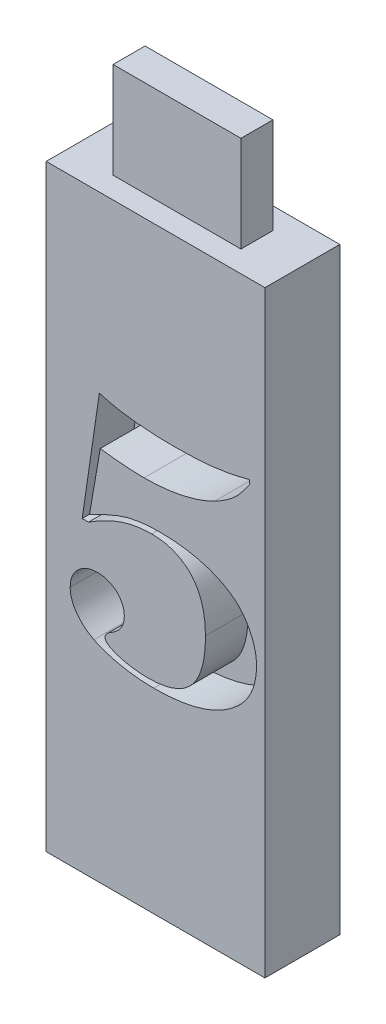
from build123d import *

# Parameters (mm, degrees)
SKETCH1_W           = 17.38
SKETCH1_H           = 47.498
BOSS_EXTRUDE1_DEPTH = 5.95
CUT_EXTRUDE1_DEPTH  = 3.41
SKETCH3_W           = 10.16
SKETCH3_H           = 2.54
BOSS_EXTRUDE2_DEPTH = 7.62


with BuildPart() as part:
    # Sketch1 → Boss-Extrude1 (new body)
    with BuildSketch(Plane.XY):
        Rectangle(SKETCH1_W, SKETCH1_H)
    extrude(amount=BOSS_EXTRUDE1_DEPTH)

    # Sketch2 → Cut-Extrude1 (cut)
    with BuildSketch(Plane.XY.offset(5.95)):
        with BuildLine():
            Line((7.442756003, 9.924455156), (7.491268126, 9.618455606))
            add(Edge.make_bspline(
                [(7.491268126, 9.618455606), (7.388196446, 9.466942554), (7.190794115, 9.176765567), (6.883635039, 8.77416687), (6.580334345, 8.424256906), (6.271574884, 8.117843462), (5.940370317, 7.841299159), (5.568441188, 7.578876003), (5.153754118, 7.310436522), (4.852926765, 7.147246701), (4.696223459, 7.062239856)],
                knots=[0, 0, 0, 0, 1.145964768, 2.194745584, 3.165202406, 4.03990847, 4.912501504, 5.860303535, 6.885415487, 8, 8, 8, 8], degree=3))
            add(Edge.make_bspline(
                [(4.696223459, 7.062239856), (4.499744398, 6.967232704), (4.102902364, 6.775340341), (3.474153814, 6.538191996), (2.813554004, 6.333237061), (2.120776353, 6.162580703), (1.399657714, 6.026815112), (0.651510405, 5.937381635), (-0.120298453, 5.873381172), (-0.643704604, 5.867395245), (-0.908792682, 5.86436357)],
                knots=[0, 0, 0, 0, 0.905325806, 1.828547692, 2.785348579, 3.774441141, 4.787925238, 5.828395329, 6.90015334, 8, 8, 8, 8], degree=3))
            add(Edge.make_bspline(
                [(-0.908792682, 5.86436357), (-1.183775776, 5.868319524), (-1.744155055, 5.876381236), (-2.60042752, 5.931891418), (-3.488027549, 6.016072254), (-4.088461448, 6.098524731), (-4.394202187, 6.140509505)],
                knots=[0, 0, 0, 0, 0.943008224, 1.921726389, 2.941743778, 4, 4, 4, 4], degree=3))
            Line((-4.394202187, 6.140509505), (-5.245030203, 1.177346077))
            add(Edge.make_bspline(
                [(-5.245030203, 1.177346077), (-5.099692133, 1.252367706), (-4.817426132, 1.398069757), (-4.4023402, 1.604243124), (-4.006704111, 1.790847965), (-3.632644493, 1.958676402), (-3.278177346, 2.103991861), (-2.947838119, 2.237174313), (-2.634386649, 2.343936776), (-2.239987634, 2.466535927), (-1.735943769, 2.588441657), (-1.096664304, 2.685171937), (-0.408909829, 2.752005624), (0.066252368, 2.757006699), (0.311473815, 2.759587651)],
                knots=[0, 0, 0, 0, 1.006594111, 1.95494061, 2.852161939, 3.698632082, 4.47771994, 5.20984462, 5.890144692, 6.514895121, 7.751501423, 9.076797217, 10.491395109, 12, 12, 12, 12], degree=3))
            add(Edge.make_bspline(
                [(0.311473815, 2.759587651), (0.535398839, 2.755977577), (0.974846729, 2.748892886), (1.620475428, 2.715284292), (2.237431508, 2.640791764), (2.828133868, 2.549610207), (3.391581711, 2.431161677), (3.926410539, 2.283829718), (4.436803767, 2.118613947), (4.916396667, 1.918999578), (5.371826845, 1.701125088), (5.793685602, 1.447774573), (6.191678015, 1.175540089), (6.432055206, 0.966979497), (6.550879266, 0.863883124)],
                knots=[0, 0, 0, 0, 1.209491551, 2.373600323, 3.489351857, 4.563959151, 5.600865615, 6.596587735, 7.558914106, 8.495791867, 9.400120309, 10.282627716, 11.15106276, 12, 12, 12, 12], degree=3))
            add(Edge.make_bspline(
                [(6.550879266, 0.863883124), (6.663701743, 0.742591932), (6.887885733, 0.501580172), (7.185905623, 0.107991252), (7.434808919, -0.317506707), (7.64735089, -0.762667624), (7.815411217, -1.223810977), (7.933572717, -1.692856119), (8.013981471, -2.164737406), (8.021265636, -2.481883253), (8.024901487, -2.64018489)],
                knots=[0, 0, 0, 0, 1.019710416, 2.026216391, 3.032489163, 4.05009723, 5.060530396, 6.048889042, 7.026113504, 8, 8, 8, 8], degree=3))
            add(Edge.make_bspline(
                [(8.024901487, -2.64018489), (8.020801767, -2.804619839), (8.012753023, -3.127445431), (7.943075826, -3.602494497), (7.831393213, -4.057156952), (7.67809346, -4.496086456), (7.475268481, -4.912593105), (7.231250027, -5.312871427), (6.938962553, -5.690361738), (6.716016962, -5.922311768), (6.603123092, -6.039765252)],
                knots=[0, 0, 0, 0, 1.041176999, 2.04408236, 3.034027167, 4.003470328, 4.983202096, 5.962965549, 6.968498547, 8, 8, 8, 8], degree=3))
            add(Edge.make_bspline(
                [(6.603123092, -6.039765252), (6.405699461, -6.215392151), (6.007486189, -6.569640332), (5.32662517, -7.011218259), (4.58377472, -7.392320821), (3.766799238, -7.694680543), (2.886211455, -7.939522552), (1.934509396, -8.101388624), (0.917305834, -8.210370201), (0.214760817, -8.221040232), (-0.14752551, -8.226542522)],
                knots=[0, 0, 0, 0, 0.871069273, 1.756990004, 2.669566264, 3.621983655, 4.627000268, 5.682036848, 6.804679652, 8, 8, 8, 8], degree=3))
            add(Edge.make_bspline(
                [(-0.14752551, -8.226542522), (-0.370250634, -8.222244049), (-0.816200421, -8.213637462), (-1.482946375, -8.166140654), (-2.145331954, -8.078795756), (-2.791605268, -7.961417463), (-3.403604951, -7.819259345), (-3.958712163, -7.654815969), (-4.453900955, -7.481257394), (-4.749947343, -7.333786701), (-4.890518529, -7.263763451)],
                knots=[0, 0, 0, 0, 1.095684565, 2.19382659, 3.285951729, 4.380508114, 5.423877159, 6.374492448, 7.228163105, 8, 8, 8, 8], degree=3))
            add(Edge.make_bspline(
                [(-4.890518529, -7.263763451), (-5.035629193, -7.182452627), (-5.316509414, -7.025065144), (-5.694035748, -6.740579878), (-6.019519859, -6.431088542), (-6.295032988, -6.097913353), (-6.51309252, -5.744206053), (-6.667017422, -5.373777783), (-6.766809982, -4.991418752), (-6.777243361, -4.730546951), (-6.782491355, -4.599328348)],
                knots=[0, 0, 0, 0, 1.160681474, 2.246647206, 3.291271732, 4.291304077, 5.25829909, 6.181203858, 7.085144929, 8, 8, 8, 8], degree=3))
            add(Edge.make_bspline(
                [(-6.782491355, -4.599328348), (-6.774342349, -4.453081073), (-6.75846843, -4.168197538), (-6.64211866, -3.759871717), (-6.436538728, -3.397764213), (-6.163895247, -3.081023671), (-5.833430689, -2.820020292), (-5.457625005, -2.631179544), (-5.044250192, -2.513816473), (-4.755734581, -2.501171297), (-4.606909191, -2.494648518)],
                knots=[0, 0, 0, 0, 1.038363749, 2.022688871, 2.983899271, 3.973918752, 4.974410771, 5.954403577, 6.944817285, 8, 8, 8, 8], degree=3))
            add(Edge.make_bspline(
                [(-4.606909191, -2.494648518), (-4.507163048, -2.496981892), (-4.312628946, -2.501532653), (-4.031008634, -2.552467514), (-3.765664982, -2.629947355), (-3.520661715, -2.74257489), (-3.294573312, -2.881087206), (-3.092603306, -3.045610231), (-2.914473539, -3.235149346), (-2.763280777, -3.446234353), (-2.638351732, -3.674894842), (-2.548205754, -3.918478563), (-2.494918861, -4.17535582), (-2.487384773, -4.350303052), (-2.483570852, -4.438865169)],
                knots=[0, 0, 0, 0, 1.117637543, 2.179719547, 3.199437565, 4.211008827, 5.194574363, 6.166491412, 7.123978993, 8.103677089, 9.071378429, 10.038174012, 11.006880757, 12, 12, 12, 12], degree=3))
            add(Edge.make_bspline(
                [(-2.483570852, -4.438865169), (-2.486995627, -4.527517151), (-2.493771023, -4.70290165), (-2.552315647, -4.956438553), (-2.640742431, -5.197727564), (-2.776563998, -5.418114374), (-2.939315934, -5.629950077), (-3.146823442, -5.820016584), (-3.384493352, -6.001663071), (-3.565500253, -6.100586139), (-3.659056927, -6.151716307)],
                knots=[0, 0, 0, 0, 0.968529955, 1.916089601, 2.833465673, 3.766948701, 4.736052034, 5.746774587, 6.835379905, 8, 8, 8, 8], degree=3))
            add(Edge.make_bspline(
                [(-3.659056927, -6.151716307), (-3.712593015, -6.195118685), (-3.810012219, -6.274097656), (-3.926920197, -6.402182193), (-4.001195782, -6.530313333), (-4.012238567, -6.618709273), (-4.017300302, -6.659227755)],
                knots=[0, 0, 0, 0, 1.288779764, 2.34518258, 3.241473203, 4, 4, 4, 4], degree=3))
            add(Edge.make_bspline(
                [(-4.017300302, -6.659227755), (-4.014862106, -6.693558852), (-4.009786068, -6.765032163), (-3.94889938, -6.86383505), (-3.865505152, -6.962509198), (-3.747621078, -7.0590999), (-3.59734133, -7.150700716), (-3.414668231, -7.240893328), (-3.200044936, -7.328812331), (-2.867030136, -7.443506304), (-2.414722193, -7.569316413), (-1.839757858, -7.670449008), (-1.236208093, -7.736106558), (-0.824385614, -7.744563892), (-0.613988238, -7.748884688)],
                knots=[0, 0, 0, 0, 0.326627239, 0.679999541, 1.087570525, 1.571741335, 2.136209263, 2.778409567, 3.529552134, 4.365937735, 6.165921372, 8.039005593, 9.976354196, 12, 12, 12, 12], degree=3))
            add(Edge.make_bspline(
                [(-0.613988238, -7.748884688), (-0.42349165, -7.745898893), (-0.053933814, -7.740106537), (0.480092866, -7.67864014), (0.976569924, -7.583764599), (1.432246926, -7.446925264), (1.848139012, -7.268810492), (2.227817186, -7.057803498), (2.567389934, -6.802022096), (2.864540024, -6.502050413), (3.12901858, -6.16407249), (3.352639163, -5.778648178), (3.54280588, -5.350498704), (3.699090595, -4.879386484), (3.817527637, -4.363147203), (3.901267526, -3.80421506), (3.954403228, -3.199710621), (3.96125619, -2.7821062), (3.964809902, -2.565550853)],
                knots=[0, 0, 0, 0, 1.145984371, 2.223176321, 3.230327741, 4.184709763, 5.080198491, 5.948392179, 6.792829292, 7.629197606, 8.482744051, 9.368637587, 10.303560962, 11.297831961, 12.351033038, 13.487071465, 14.696881343, 16, 16, 16, 16], degree=3))
            add(Edge.make_bspline(
                [(3.964809902, -2.565550853), (3.959937282, -2.315186172), (3.95054273, -1.832475769), (3.854905269, -1.138827256), (3.705638698, -0.502736617), (3.487857452, 0.072698671), (3.212336232, 0.590456281), (2.869977731, 1.042931556), (2.464404193, 1.430095093), (1.998885296, 1.746615006), (1.483054716, 1.997270407), (0.925314836, 2.181919986), (0.322799369, 2.28608044), (-0.091155302, 2.300584907), (-0.304256986, 2.308051731)],
                knots=[0, 0, 0, 0, 1.224131662, 2.360161531, 3.418424534, 4.414143726, 5.361687872, 6.278160415, 7.177748908, 8.092603741, 9.020660508, 9.975155306, 10.957620613, 12, 12, 12, 12], degree=3))
            add(Edge.make_bspline(
                [(-0.304256986, 2.308051731), (-0.585965965, 2.299911613), (-1.136361477, 2.284007669), (-1.811836605, 2.167686698), (-2.337007345, 2.039517007), (-2.732310337, 1.908362031), (-3.140497373, 1.762367668), (-3.553566201, 1.578877843), (-3.981742925, 1.379844177), (-4.417153582, 1.143324516), (-4.874022359, 0.893907905), (-5.176248262, 0.706169561), (-5.330859345, 0.6101274)],
                knots=[0, 0, 0, 0, 1.569199768, 3.065860781, 3.809147302, 4.580990623, 5.38603441, 6.224540817, 7.099163695, 8.017256459, 8.985678849, 10, 10, 10, 10], degree=3))
            Line((-5.330859345, 0.6101274), (-5.827175687, 0.6101274))
            Line((-5.827175687, 0.6101274), (-4.465104521, 9.924455156))
            add(Edge.make_bspline(
                [(-4.465104521, 9.924455156), (-4.315984039, 9.880431687), (-4.028541468, 9.795572662), (-3.610488685, 9.680706455), (-3.217546123, 9.59555299), (-2.963853205, 9.550545578), (-2.841814227, 9.528894762)],
                knots=[0, 0, 0, 0, 1.115879267, 2.150953381, 3.110516124, 4, 4, 4, 4], degree=3))
            add(Edge.make_bspline(
                [(-2.841814227, 9.528894762), (-2.510146411, 9.477884697), (-1.830201619, 9.373310099), (-0.775608412, 9.285032005), (0.332929285, 9.21530606), (1.09127166, 9.210452917), (1.479496486, 9.207968405)],
                knots=[0, 0, 0, 0, 0.928037139, 1.90254824, 2.926233227, 4, 4, 4, 4], degree=3))
            add(Edge.make_bspline(
                [(1.479496486, 9.207968405), (1.857705195, 9.211620808), (2.587136827, 9.218665008), (3.650367069, 9.270738299), (4.655930506, 9.361259539), (5.618408289, 9.504787441), (6.545008139, 9.689890411), (7.146144347, 9.846956071), (7.442756003, 9.924455156)],
                knots=[0, 0, 0, 0, 1.129737635, 2.178866713, 3.179008279, 4.144335706, 5.084381125, 6, 6, 6, 6], degree=3))
        make_face()
    extrude(amount=-CUT_EXTRUDE1_DEPTH, mode=Mode.SUBTRACT)

    # Sketch3 → Boss-Extrude2 (add)
    with BuildSketch(Plane(origin=(0, 23.749, 0), x_dir=(1, 0, 0), z_dir=(0, 1, 0))):
        with Locations((0, -2.975)):
            Rectangle(SKETCH3_W, SKETCH3_H)
    extrude(amount=BOSS_EXTRUDE2_DEPTH)


solid = part.part
